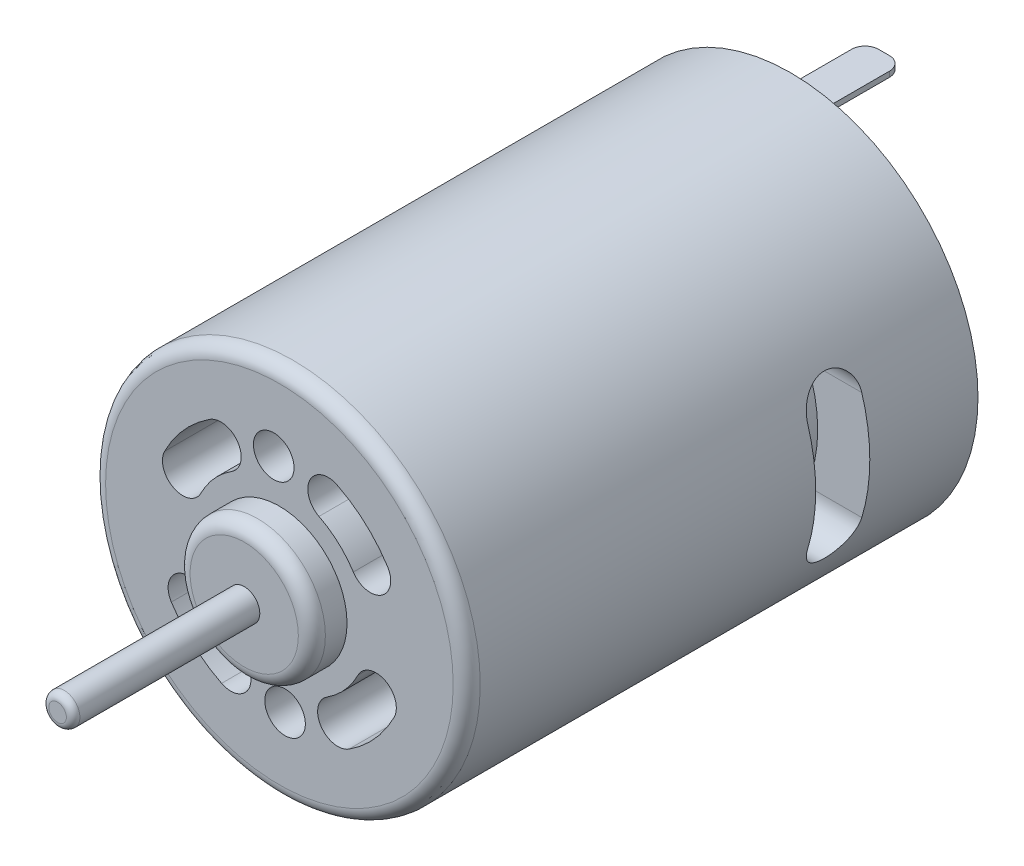
from build123d import *

# Parameters (mm, degrees)
SKETCH_1_R               = 13.85
EXTRUDE_1_DEPTH          = 37.8
FILLET_1_R               = 1
SKETCH_2_R               = 5
EXTRUDE_2_DEPTH          = 2.6
FILLET_2_R               = 1
SKETCH_3_R               = 1.15
EXTRUDE_3_DEPTH          = 13.8
FILLET_3_R               = 0.5
SKETCH_5_R               = 1.5
CUT_EXTRUDE_1_DEPTH      = 6
EXTRUDE_START            = 2.6
SKETCH_6_R               = 5
EXTRUDE_4_DEPTH          = 2.6
FILLET_4_R               = 1
SKETCH_7_W               = 2.8
SKETCH_7_H               = 0.4
EXTRUDE_5_DEPTH          = 6.9
FILLET_5_R               = 1
CUT_EXTRUDE_3_DEPTH      = 58.630590859
EXTRUDE_7_DEPTH          = 30
CUT_EXTRUDE_2_DEPTH      = 58.630590859
CUT_EXTRUDE_2_DEPTH_BACK = 58.630590859
SKETCH_9_R               = 10
EXTRUDE_6_DEPTH          = 20


with BuildPart() as part:
    # ｽｹｯﾁ1 → ﾎﾞｽ - 押し出し1 (new body)
    with BuildSketch(Plane.XY):
        Circle(SKETCH_1_R)
    extrude(amount=EXTRUDE_1_DEPTH)

    # ﾌｨﾚｯﾄ1
    fillet_1_edges = [part.edges().sort_by_distance(p)[0] for p in [
        (-13.85, 0, 37.8),
    ]]
    fillet(fillet_1_edges, radius=FILLET_1_R)

    # ｽｹｯﾁ2 → ﾎﾞｽ - 押し出し2 (add)
    with BuildSketch(Plane.XY.offset(37.8)):
        Circle(SKETCH_2_R)
    extrude(amount=EXTRUDE_2_DEPTH)

    # ﾌｨﾚｯﾄ2
    fillet_2_edges = [part.edges().sort_by_distance(p)[0] for p in [
        (-5, 0, 40.4),
    ]]
    fillet(fillet_2_edges, radius=FILLET_2_R)

    # ｽｹｯﾁ3 → ﾎﾞｽ - 押し出し3 (add)
    with BuildSketch(Plane.XY.offset(40.4)):
        with Locations(Location((0, 0, 0), (0, 0, 180))):
            Circle(SKETCH_3_R)
    extrude(amount=EXTRUDE_3_DEPTH)

    # ﾌｨﾚｯﾄ3
    fillet_3_edges = [part.edges().sort_by_distance(p)[0] for p in [
        (1.15, 0, 54.2),
    ]]
    fillet(fillet_3_edges, radius=FILLET_3_R)

    # ｽｹｯﾁ5 → ｶｯﾄ - 押し出し1 (cut)
    with BuildSketch(Plane.XY.offset(37.8)):
        with Locations((-0.41868765, 7.989036278)):
            Circle(SKETCH_5_R)
        with Locations((0.41868765, -7.989036278)):
            Circle(SKETCH_5_R)
        with BuildLine():
            ThreePointArc((7.990545371, 5.138208314), (6.35674076, 7.059875842), (4.274821243, 8.483861346))
            ThreePointArc((4.274821243, 8.483861346), (2.260292413, 7.819276067), (2.924877693, 5.804747237))
            ThreePointArc((2.924877693, 5.804747237), (4.349348941, 4.830441366), (5.467215254, 3.515616215))
            ThreePointArc((5.467215254, 3.515616215), (7.540176362, 3.065247206), (7.990545371, 5.138208314))
        make_face()
        with BuildLine():
            ThreePointArc((5.138208314, -7.990545371), (7.059875842, -6.35674076), (8.483861346, -4.274821243))
            ThreePointArc((8.483861346, -4.274821243), (7.819276067, -2.260292413), (5.804747237, -2.924877693))
            ThreePointArc((5.804747237, -2.924877693), (4.830441366, -4.349348941), (3.515616215, -5.467215254))
            ThreePointArc((3.515616215, -5.467215254), (3.065247206, -7.540176362), (5.138208314, -7.990545371))
        make_face()
        with BuildLine():
            ThreePointArc((-7.990545371, -5.138208314), (-6.35674076, -7.059875842), (-4.274821243, -8.483861346))
            ThreePointArc((-4.274821243, -8.483861346), (-2.260292413, -7.819276067), (-2.924877693, -5.804747237))
            ThreePointArc((-2.924877693, -5.804747237), (-4.349348941, -4.830441366), (-5.467215254, -3.515616215))
            ThreePointArc((-5.467215254, -3.515616215), (-7.540176362, -3.065247206), (-7.990545371, -5.138208314))
        make_face()
        with BuildLine():
            ThreePointArc((-5.138208314, 7.990545371), (-7.059875842, 6.35674076), (-8.483861346, 4.274821243))
            ThreePointArc((-8.483861346, 4.274821243), (-7.819276067, 2.260292413), (-5.804747237, 2.924877693))
            ThreePointArc((-5.804747237, 2.924877693), (-4.830441366, 4.349348941), (-3.515616215, 5.467215254))
            ThreePointArc((-3.515616215, 5.467215254), (-3.065247206, 7.540176362), (-5.138208314, 7.990545371))
        make_face()
    extrude(amount=-CUT_EXTRUDE_1_DEPTH, mode=Mode.SUBTRACT)

    # ｽｹｯﾁ6 → ﾎﾞｽ - 押し出し4 (add)
    with BuildSketch(Plane(origin=(0, 0, 0), x_dir=(-1, 0, 0), z_dir=(0, 0, -1)).offset(EXTRUDE_START)):
        with Locations(Location((0, 0, 0), (0, 0, 180))):
            Circle(SKETCH_6_R)
    extrude(amount=-EXTRUDE_4_DEPTH)

    # ﾌｨﾚｯﾄ4
    fillet_4_edges = [part.edges().sort_by_distance(p)[0] for p in [
        (-5, 0, -2.6),
    ]]
    fillet(fillet_4_edges, radius=FILLET_4_R)

    # ｽｹｯﾁ7 → ﾎﾞｽ - 押し出し5 (add)
    with BuildSketch(Plane(origin=(0, 0, 0), x_dir=(-1, 0, 0), z_dir=(0, 0, -1))):
        with Locations((0, 11.5)):
            Rectangle(SKETCH_7_W, SKETCH_7_H)
        with Locations((0, -11.5)):
            Rectangle(SKETCH_7_W, SKETCH_7_H)
    extrude(amount=EXTRUDE_5_DEPTH)

    # ﾌｨﾚｯﾄ5
    fillet_5_edges = [part.edges().sort_by_distance(p)[0] for p in [
        (-1.4, -11.5, -6.9),
        (1.4, -11.5, -6.9),
        (-1.4, 11.5, -6.9),
        (1.4, 11.5, -6.9),
    ]]
    fillet(fillet_5_edges, radius=FILLET_5_R)

    # ｽｹｯﾁ10 → ｶｯﾄ - 押し出し3 (cut, through all)
    with BuildSketch(Plane(origin=(0, 0, 0), x_dir=(0, 0, -1), z_dir=(1, 0, 0))):
        Polygon((-26.8, 5), (-20.8, 5), (-17.8, 3.5), (-17.8, 2), (-26.8, 2), align=None)
        Polygon((-26.8, -2), (-17.8, -2), (-17.8, -3.5), (-20.8, -5), (-26.8, -5), align=None)
    extrude(amount=-CUT_EXTRUDE_3_DEPTH, mode=Mode.SUBTRACT)

    # ｽｹｯﾁ11 → ﾎﾞｽ - 押し出し7 (add)
    with BuildSketch(Plane(origin=(0, 0, 0), x_dir=(-1, 0, 0), z_dir=(0, 0, -1))):
        with BuildLine():
            Line((-13.704834913, 2), (-2, 13.704834913))
            ThreePointArc((-2, 13.704834913), (0, 13.85), (2, 13.704834913))
            Line((2, 13.704834913), (13.704834913, 2))
            ThreePointArc((13.704834913, 2), (13.85, 0), (13.704834913, -2))
            Line((13.704834913, -2), (2, -13.704834913))
            ThreePointArc((2, -13.704834913), (0, -13.85), (-2, -13.704834913))
            Line((-2, -13.704834913), (-13.704834913, -2))
            ThreePointArc((-13.704834913, -2), (-13.85, 0), (-13.704834913, 2))
        make_face()
    extrude(amount=-EXTRUDE_7_DEPTH)

    # ｽｹｯﾁ8 → ｶｯﾄ - 押し出し2 (cut, two sides: drawn at the far end of the back side and taken through both)
    with BuildSketch(Plane(origin=(0, 0, 0), x_dir=(0, 0, -1), z_dir=(1, 0, 0)).offset(-CUT_EXTRUDE_2_DEPTH_BACK)):
        with BuildLine():
            Line((-8, 4), (-8, -4))
            ThreePointArc((-8, -4), (-10, -6), (-12, -4))
            Line((-12, -4), (-12, 4))
            ThreePointArc((-12, 4), (-10, 6), (-8, 4))
        make_face()
    extrude(amount=CUT_EXTRUDE_2_DEPTH + CUT_EXTRUDE_2_DEPTH_BACK, mode=Mode.SUBTRACT)

    # ｽｹｯﾁ9 → ﾎﾞｽ - 押し出し6 (add)
    with BuildSketch(Plane(origin=(0, 0, 0), x_dir=(-1, 0, 0), z_dir=(0, 0, -1))):
        Circle(SKETCH_9_R)
    extrude(amount=-EXTRUDE_6_DEPTH)


solid = part.part
